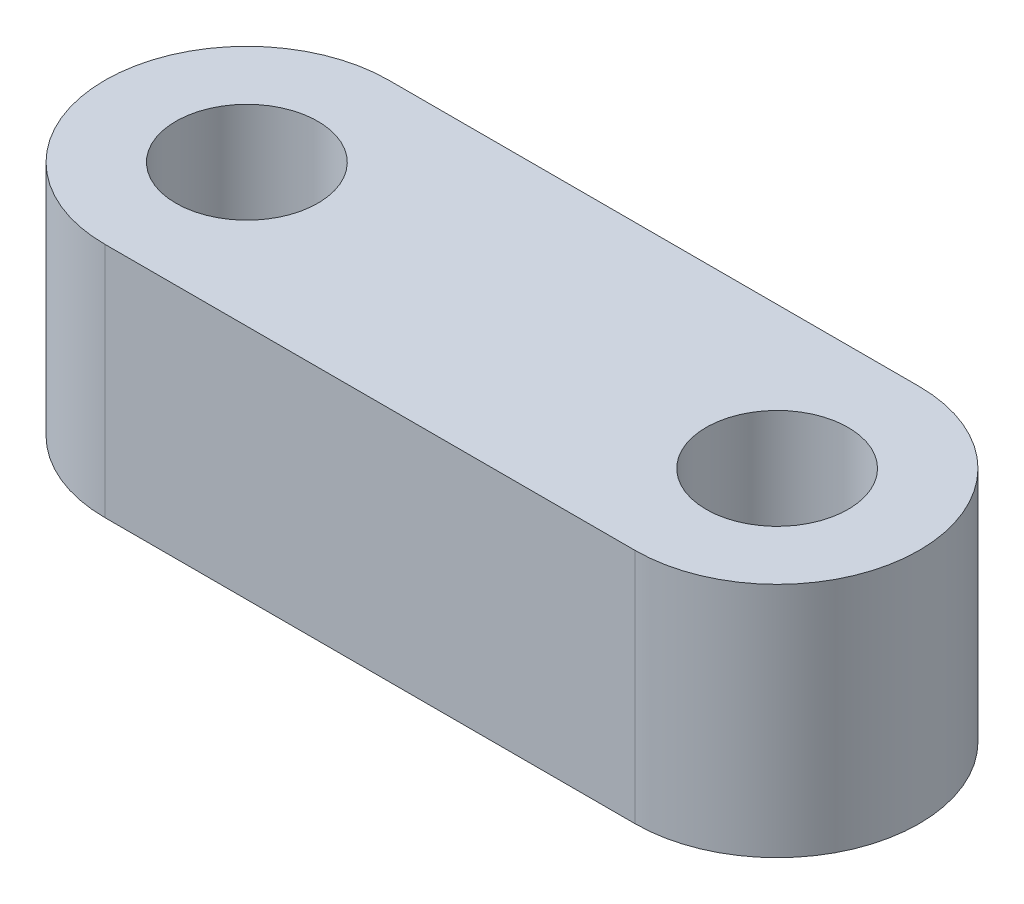
from build123d import *

# Parameters (mm, degrees)
SKETCH1_R           = 30
BOSS_EXTRUDE1_DEPTH = 100


with BuildPart() as part:
    # Sketch1 → Boss-Extrude1 (new body)
    with BuildSketch(Plane(origin=(0, 0, 0), x_dir=(1, 0, 0), z_dir=(0, 1, 0))):
        with BuildLine():
            Line((0, 60), (224, 60))
            ThreePointArc((224, 60), (284, 0), (224, -60))
            Line((224, -60), (0, -60))
            ThreePointArc((0, -60), (-60, 0), (0, 60))
        make_face()
        with Locations(Location((0, 0, 0), (0, 0, 270))):
            Circle(SKETCH1_R, mode=Mode.SUBTRACT)
        with Locations(Location((224, 0, 0), (0, 0, 270))):
            Circle(SKETCH1_R, mode=Mode.SUBTRACT)
    extrude(amount=BOSS_EXTRUDE1_DEPTH)


solid = part.part
